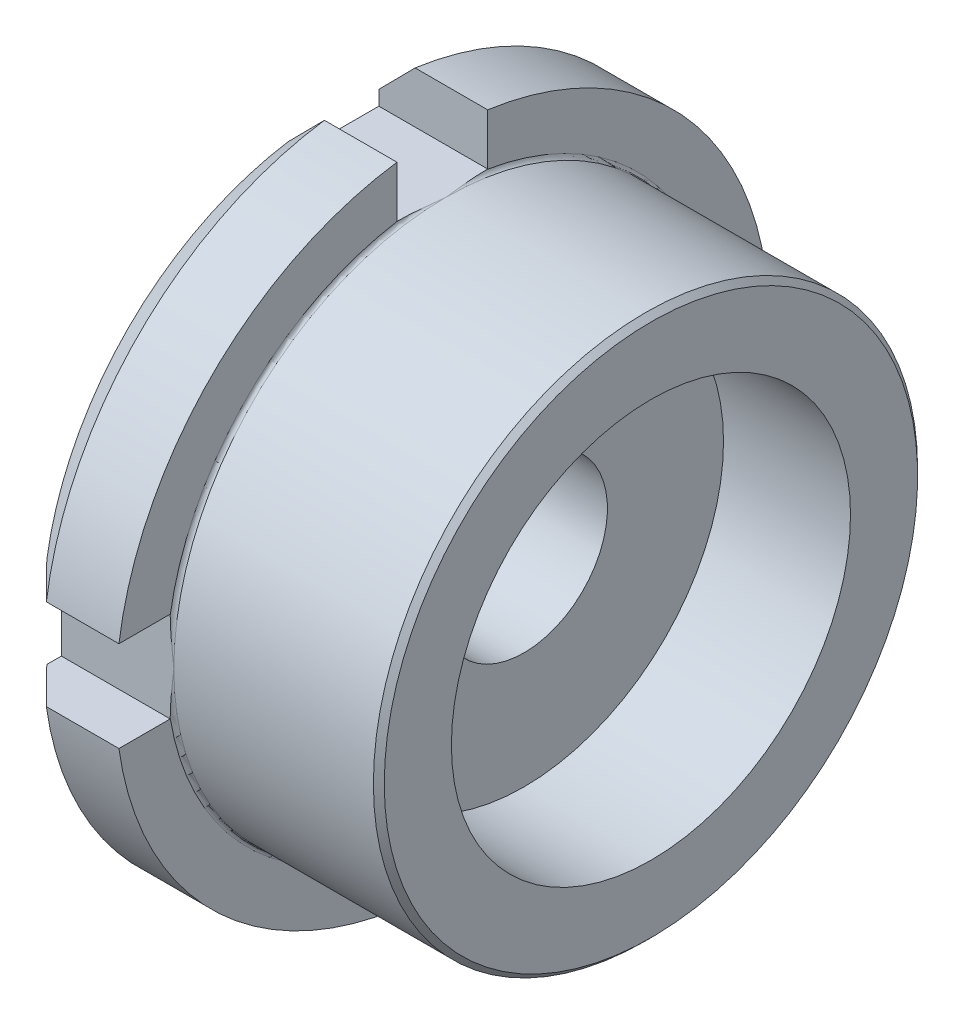
from build123d import *

# Parameters (mm, degrees)
CUT_EXTRUDE3_DEPTH = 31.890937182
CIRPATTERN1_COUNT  = 4
CHAMFER1_SIZE      = 0.3


with BuildPart() as part:
    # Sketch1 → Revolve2 (revolve)
    with BuildSketch(Plane.XY, mode=Mode.PRIVATE) as revolve2_sk:
        with BuildLine():
            Line((17.605343981, 11), (17.605343981, 15))
            Line((17.605343981, 15), (6.305343981, 15))
            ThreePointArc((6.305343981, 15), (6.163922625, 15.058578644), (6.105343981, 15.2))
            Line((6.105343981, 15.2), (6.105343981, 18))
            Line((6.105343981, 18), (2.105343981, 18))
            Line((2.105343981, 18), (0.105343981, 16))
            Line((0.105343981, 16), (0.105343981, 11.1))
            ThreePointArc((0.105343981, 11.1), (0.3982372, 10.392893219), (1.105343981, 10.1))
            Line((1.105343981, 10.1), (4.605343981, 10.1))
            ThreePointArc((4.605343981, 10.1), (5.312450762, 9.807106781), (5.605343981, 9.1))
            Line((5.605343981, 9.1), (5.605343981, 4.6))
            Line((5.605343981, 4.6), (10.605343981, 4.6))
            Line((10.605343981, 4.6), (10.605343981, 11))
            Line((10.605343981, 11), (17.605343981, 11))
        make_face()
    revolve(revolve2_sk.sketch.rotate(Axis((0, 0, 0), (1, 0, 0)), 90), axis=Axis((0, 0, 0), (1, 0, 0)))

    # Sketch5 → Cut-Extrude3 (cut, through all)
    with BuildSketch(Plane.ZY.offset(-0.105343981)):
        with BuildLine():
            Line((0, 15), (0, 16))
            ThreePointArc((0, 16), (-1.253856039, 15.950794495), (-2.5, 15.803480629))
            Line((-2.5, 15.803480629), (-2.5, 15))
            Line((-2.5, 15), (0, 15))
        make_face()
        with BuildLine():
            ThreePointArc((2.5, 15.803480629), (1.253856039, 15.950794495), (0, 16))
            Line((0, 16), (0, 15))
            Line((0, 15), (2.5, 15))
            Line((2.5, 15), (2.5, 15.803480629))
        make_face()
        with BuildLine():
            Line((0, 18.508345056), (0, 18))
            Line((0, 18), (0, 16))
            ThreePointArc((0, 16), (1.253856039, 15.950794495), (2.5, 15.803480629))
            Line((2.5, 15.803480629), (2.5, 18.508345056))
            Line((2.5, 18.508345056), (0, 18.508345056))
        make_face()
        with BuildLine():
            Line((0, 16), (0, 18))
            Line((0, 18), (0, 18.508345056))
            Line((0, 18.508345056), (-2.5, 18.508345056))
            Line((-2.5, 18.508345056), (-2.5, 15.803480629))
            ThreePointArc((-2.5, 15.803480629), (-1.253856039, 15.950794495), (0, 16))
        make_face()
    cut_extrude3 = extrude(amount=-CUT_EXTRUDE3_DEPTH, mode=Mode.SUBTRACT)

    # CirPattern1: Cut-Extrude3 ×4 about axis
    cirpattern1_axis = Axis((0, 0, 0), (1, 0, 0))
    for i in range(1, CIRPATTERN1_COUNT):
        add(cut_extrude3.rotate(cirpattern1_axis, i * 360 / CIRPATTERN1_COUNT), mode=Mode.SUBTRACT)

    # Chamfer1
    chamfer1_edges = [part.edges().sort_by_distance(p)[0] for p in [
        (17.605343981, 0, -15),
    ]]
    chamfer(chamfer1_edges, length=CHAMFER1_SIZE)


solid = part.part
